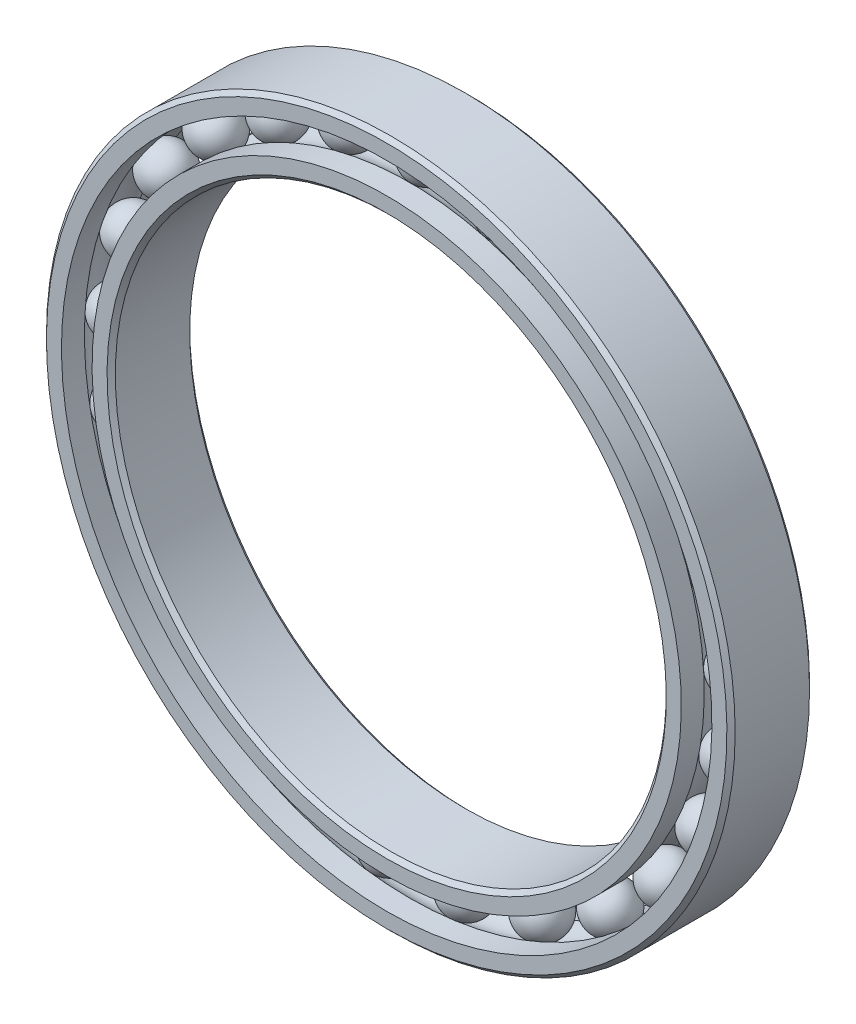
from build123d import *

# Parameters (mm, degrees)
CIRPATTERN1_COUNT = 25


with BuildPart() as part:
    # Sketch6 → Revolve5 (revolve)
    with BuildSketch(Plane(origin=(0, 0, 0), x_dir=(0, 0, -1), z_dir=(1, 0, 0)), mode=Mode.PRIVATE) as revolve5_sk:
        with BuildLine():
            Line((2.7, 25), (3, 24.7))
            Line((3, 24.7), (3, 23.611111111))
            Line((3, 23.611111111), (1.333333333, 23.611111111))
            ThreePointArc((1.333333333, 23.611111111), (0, 24.235611039), (-1.333333333, 23.611111111))
            Line((-1.333333333, 23.611111111), (-3, 23.611111111))
            Line((-3, 23.611111111), (-3, 24.7))
            Line((-3, 24.7), (-2.7, 25))
            Line((-2.7, 25), (2.7, 25))
        make_face()
    revolve(revolve5_sk.sketch.rotate(Axis((0, 0, 3), (0, 0, -1)), 180), axis=Axis((0, 0, 3), (0, 0, -1)))


with BuildPart() as body_2:
    # Sketch3 → Revolve3 (revolve)
    with BuildSketch(Plane(origin=(0, 0, 0), x_dir=(0, 0, -1), z_dir=(1, 0, 0)), mode=Mode.PRIVATE) as revolve3_sk:
        with BuildLine():
            Line((-3, 21.388888889), (-1.333333333, 21.388888889))
            ThreePointArc((-1.333333333, 21.388888889), (0, 20.764388961), (1.333333333, 21.388888889))
            Line((1.333333333, 21.388888889), (3, 21.388888889))
            Line((3, 21.388888889), (3, 20.3))
            Line((3, 20.3), (2.7, 20))
            Line((2.7, 20), (-2.7, 20))
            Line((-2.7, 20), (-3, 20.3))
            Line((-3, 20.3), (-3, 21.388888889))
        make_face()
    revolve(revolve3_sk.sketch.rotate(Axis((0, 0, 3), (0, 0, -1)), 180), axis=Axis((0, 0, 3), (0, 0, -1)))


with BuildPart() as body_3:
    # Sketch4 → Revolve4 (revolve)
    with BuildSketch(Plane(origin=(0, 0, 0), x_dir=(0, 0, -1), z_dir=(1, 0, 0))):
        with BuildLine():
            Line((-1.735611039, 22.5), (1.735611039, 22.5))
            ThreePointArc((1.735611039, 22.5), (0, 24.235611039), (-1.735611039, 22.5))
        make_face()
    revolve(axis=Axis((0, 22.5, 1.735611039), (0, 0, -1)))


with BuildPart() as cirpattern1_1:
    # CirPattern1: pattern copy
    add(body_3.part.rotate(Axis((0, 0, 0), (0, 0, 1)), 1 * 360 / CIRPATTERN1_COUNT))


with BuildPart() as cirpattern1_2:
    # CirPattern1: pattern copy
    add(body_3.part.rotate(Axis((0, 0, 0), (0, 0, 1)), 2 * 360 / CIRPATTERN1_COUNT))


with BuildPart() as cirpattern1_3:
    # CirPattern1: pattern copy
    add(body_3.part.rotate(Axis((0, 0, 0), (0, 0, 1)), 3 * 360 / CIRPATTERN1_COUNT))


with BuildPart() as cirpattern1_4:
    # CirPattern1: pattern copy
    add(body_3.part.rotate(Axis((0, 0, 0), (0, 0, 1)), 4 * 360 / CIRPATTERN1_COUNT))


with BuildPart() as cirpattern1_5:
    # CirPattern1: pattern copy
    add(body_3.part.rotate(Axis((0, 0, 0), (0, 0, 1)), 5 * 360 / CIRPATTERN1_COUNT))


with BuildPart() as cirpattern1_6:
    # CirPattern1: pattern copy
    add(body_3.part.rotate(Axis((0, 0, 0), (0, 0, 1)), 6 * 360 / CIRPATTERN1_COUNT))


with BuildPart() as cirpattern1_7:
    # CirPattern1: pattern copy
    add(body_3.part.rotate(Axis((0, 0, 0), (0, 0, 1)), 7 * 360 / CIRPATTERN1_COUNT))


with BuildPart() as cirpattern1_8:
    # CirPattern1: pattern copy
    add(body_3.part.rotate(Axis((0, 0, 0), (0, 0, 1)), 8 * 360 / CIRPATTERN1_COUNT))


with BuildPart() as cirpattern1_9:
    # CirPattern1: pattern copy
    add(body_3.part.rotate(Axis((0, 0, 0), (0, 0, 1)), 9 * 360 / CIRPATTERN1_COUNT))


with BuildPart() as cirpattern1_10:
    # CirPattern1: pattern copy
    add(body_3.part.rotate(Axis((0, 0, 0), (0, 0, 1)), 10 * 360 / CIRPATTERN1_COUNT))


with BuildPart() as cirpattern1_11:
    # CirPattern1: pattern copy
    add(body_3.part.rotate(Axis((0, 0, 0), (0, 0, 1)), 11 * 360 / CIRPATTERN1_COUNT))


with BuildPart() as cirpattern1_12:
    # CirPattern1: pattern copy
    add(body_3.part.rotate(Axis((0, 0, 0), (0, 0, 1)), 12 * 360 / CIRPATTERN1_COUNT))


with BuildPart() as cirpattern1_13:
    # CirPattern1: pattern copy
    add(body_3.part.rotate(Axis((0, 0, 0), (0, 0, 1)), 13 * 360 / CIRPATTERN1_COUNT))


with BuildPart() as cirpattern1_14:
    # CirPattern1: pattern copy
    add(body_3.part.rotate(Axis((0, 0, 0), (0, 0, 1)), 14 * 360 / CIRPATTERN1_COUNT))


with BuildPart() as cirpattern1_15:
    # CirPattern1: pattern copy
    add(body_3.part.rotate(Axis((0, 0, 0), (0, 0, 1)), 15 * 360 / CIRPATTERN1_COUNT))


with BuildPart() as cirpattern1_16:
    # CirPattern1: pattern copy
    add(body_3.part.rotate(Axis((0, 0, 0), (0, 0, 1)), 16 * 360 / CIRPATTERN1_COUNT))


with BuildPart() as cirpattern1_17:
    # CirPattern1: pattern copy
    add(body_3.part.rotate(Axis((0, 0, 0), (0, 0, 1)), 17 * 360 / CIRPATTERN1_COUNT))


with BuildPart() as cirpattern1_18:
    # CirPattern1: pattern copy
    add(body_3.part.rotate(Axis((0, 0, 0), (0, 0, 1)), 18 * 360 / CIRPATTERN1_COUNT))


with BuildPart() as cirpattern1_19:
    # CirPattern1: pattern copy
    add(body_3.part.rotate(Axis((0, 0, 0), (0, 0, 1)), 19 * 360 / CIRPATTERN1_COUNT))


with BuildPart() as cirpattern1_20:
    # CirPattern1: pattern copy
    add(body_3.part.rotate(Axis((0, 0, 0), (0, 0, 1)), 20 * 360 / CIRPATTERN1_COUNT))


with BuildPart() as cirpattern1_21:
    # CirPattern1: pattern copy
    add(body_3.part.rotate(Axis((0, 0, 0), (0, 0, 1)), 21 * 360 / CIRPATTERN1_COUNT))


with BuildPart() as cirpattern1_22:
    # CirPattern1: pattern copy
    add(body_3.part.rotate(Axis((0, 0, 0), (0, 0, 1)), 22 * 360 / CIRPATTERN1_COUNT))


with BuildPart() as cirpattern1_23:
    # CirPattern1: pattern copy
    add(body_3.part.rotate(Axis((0, 0, 0), (0, 0, 1)), 23 * 360 / CIRPATTERN1_COUNT))


with BuildPart() as cirpattern1_24:
    # CirPattern1: pattern copy
    add(body_3.part.rotate(Axis((0, 0, 0), (0, 0, 1)), 24 * 360 / CIRPATTERN1_COUNT))


solid = Compound([part.part, body_2.part, body_3.part, cirpattern1_1.part, cirpattern1_2.part, cirpattern1_3.part, cirpattern1_4.part, cirpattern1_5.part, cirpattern1_6.part, cirpattern1_7.part, cirpattern1_8.part, cirpattern1_9.part, cirpattern1_10.part, cirpattern1_11.part, cirpattern1_12.part, cirpattern1_13.part, cirpattern1_14.part, cirpattern1_15.part, cirpattern1_16.part, cirpattern1_17.part, cirpattern1_18.part, cirpattern1_19.part, cirpattern1_20.part, cirpattern1_21.part, cirpattern1_22.part, cirpattern1_23.part, cirpattern1_24.part])
